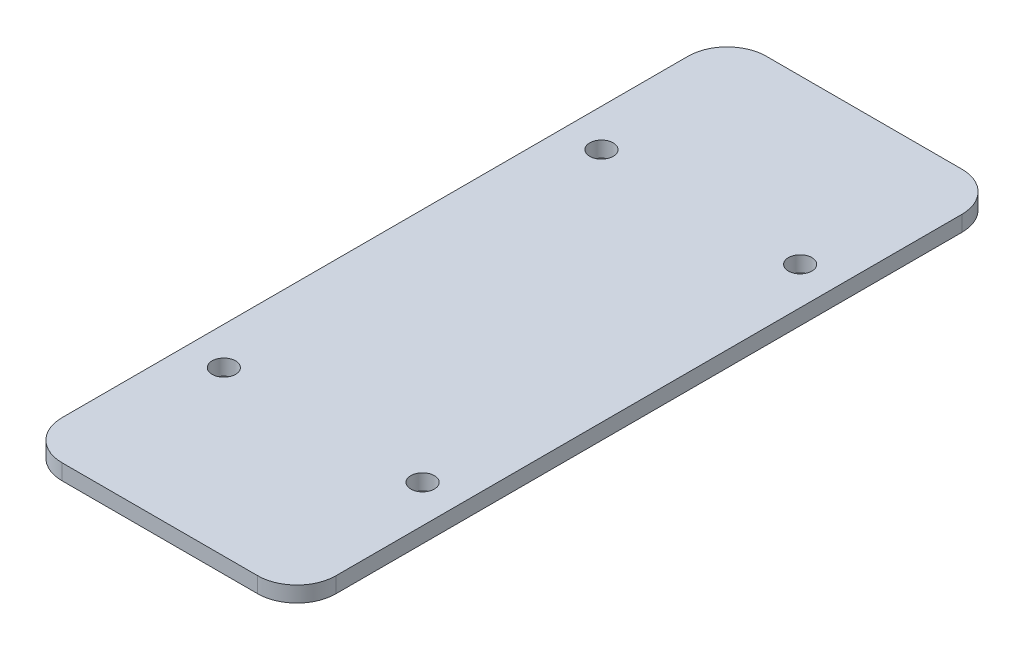
from build123d import *

# Parameters (mm, degrees)
SKETCH_1_W          = 35
SKETCH_1_H          = 90
EXTRUDE_1_DEPTH     = 2
SKETCH_2_R          = 1.5
CUT_EXTRUDE_1_DEPTH = 49.324424466
FILLET_1_R          = 5


with BuildPart() as part:
    # 草图1 → 凸台-拉伸1 (new body)
    with BuildSketch(Plane(origin=(0, 0, 0), x_dir=(1, 0, 0), z_dir=(0, 1, 0))):
        Rectangle(SKETCH_1_W, SKETCH_1_H)
    extrude(amount=EXTRUDE_1_DEPTH)

    # 草图2 → 切除-拉伸1 (cut, through all)
    with BuildSketch(Plane(origin=(0, 2, 0), x_dir=(1, 0, 0), z_dir=(0, 1, 0))):
        with Locations(Location((-12.7, 24.13, 0), (0, 0, 270))):
            Circle(SKETCH_2_R)
        with Locations(Location((12.7, 24.13, 0), (0, 0, 270))):
            Circle(SKETCH_2_R)
        with Locations(Location((12.7, -24.13, 0), (0, 0, 270))):
            Circle(SKETCH_2_R)
        with Locations(Location((-12.7, -24.13, 0), (0, 0, 270))):
            Circle(SKETCH_2_R)
    extrude(amount=-CUT_EXTRUDE_1_DEPTH, mode=Mode.SUBTRACT)

    # 圆角1
    fillet_1_edges = [part.edges().sort_by_distance(p)[0] for p in [
        (17.5, 1, 45),
        (-17.5, 1, 45),
        (-17.5, 1, -45),
        (17.5, 1, -45),
    ]]
    fillet(fillet_1_edges, radius=FILLET_1_R)


solid = part.part
